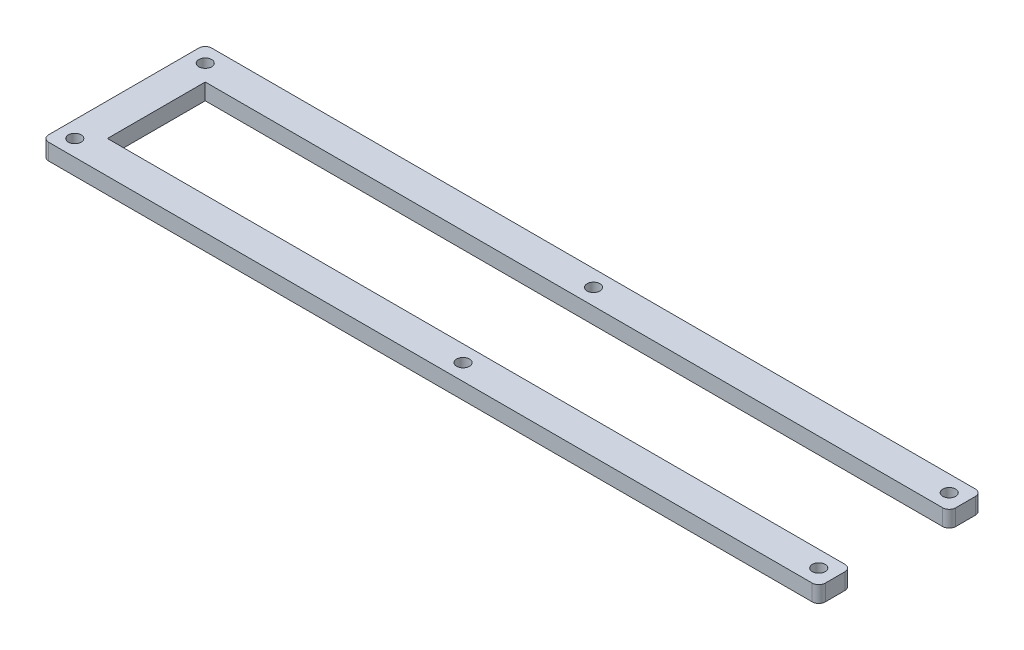
from build123d import *

# Parameters (mm, degrees)
SKETCH1_W           = 289.69
SKETCH1_H           = 12.7
SKETCH1_R           = 2.49
BOSS_EXTRUDE1_DEPTH = 6.35
FILLET1_R           = 2.54


with BuildPart() as part:
    # Sketch1 → Boss-Extrude1 (new body)
    # profile 1 of 3: a face of its own
    with BuildSketch(Plane(origin=(0, 0, 0), x_dir=(1, 0, 0), z_dir=(0, 1, 0))):
        with Locations((0, -25.4)):
            Rectangle(SKETCH1_W, SKETCH1_H)
        with Locations(Location((138.495, -25.4, 0), (0, 0, 270))):
            Circle(SKETCH1_R, mode=Mode.SUBTRACT)
        with Locations(Location((0, -25.4, 0), (0, 0, 270))):
            Circle(SKETCH1_R, mode=Mode.SUBTRACT)
    # profile 2 of 3: a face of its own
    with BuildSketch(Plane(origin=(0, 0, 0), x_dir=(1, 0, 0), z_dir=(0, 1, 0))):
        Polygon((-144.845, 31.75), (-157.545, 31.75), (-157.545, -31.75), (-144.845, -31.75), (-144.845, -19.05), (-144.845, 19.05), align=None)
        with Locations(Location((-151.195, -25.4, 0), (0, 0, 270))):
            Circle(SKETCH1_R, mode=Mode.SUBTRACT)
        with Locations(Location((-151.195, 25.4, 0), (0, 0, 270))):
            Circle(SKETCH1_R, mode=Mode.SUBTRACT)
    # profile 3 of 3: a face of its own
    with BuildSketch(Plane(origin=(0, 0, 0), x_dir=(1, 0, 0), z_dir=(0, 1, 0))):
        with Locations((0, 25.4)):
            Rectangle(SKETCH1_W, SKETCH1_H)
        with Locations(Location((138.495, 25.4, 0), (0, 0, 270))):
            Circle(SKETCH1_R, mode=Mode.SUBTRACT)
        with Locations(Location((0, 25.4, 0), (0, 0, 270))):
            Circle(SKETCH1_R, mode=Mode.SUBTRACT)
    extrude(amount=BOSS_EXTRUDE1_DEPTH)

    # Fillet1
    fillet1_edges = [part.edges().sort_by_distance(p)[0] for p in [
        (144.845, 3.175, 19.05),
        (144.845, 3.175, 31.75),
        (-157.545, 3.175, 31.75),
        (-157.545, 3.175, -31.75),
        (144.845, 3.175, -31.75),
        (144.845, 3.175, -19.05),
    ]]
    fillet(fillet1_edges, radius=FILLET1_R)


solid = part.part
